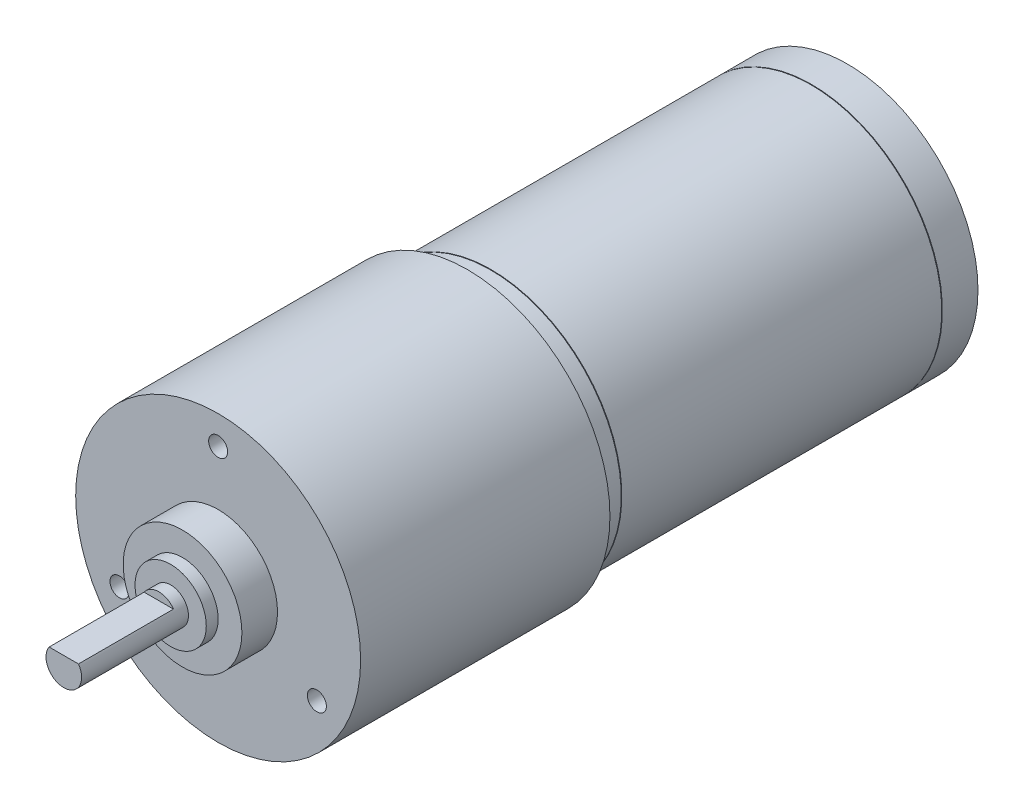
from build123d import *

# Parameters (mm, degrees)
SKETCH_1_R             = 11
EXTRUDE_1_DEPTH        = 32
HOLE_WIZARD_M2_1_D     = 1.6
HOLE_WIZARD_M2_1_DEPTH = 5.2
HOLE_WIZARD_M2_1_TIP   = 0.480688495
CUT_EXTRUDE_START      = -3
SKETCH_5_R             = 11.838448527
SKETCH_5_R_2           = 10.75
CUT_EXTRUDE_1_DEPTH    = 0.05
CUT_EXTRUDE_START_2    = -30
SKETCH_5_2_R           = 11.838448527
SKETCH_5_2_R_2         = 10.75
CUT_EXTRUDE_2_DEPTH    = 0.05
SKETCH_6_R             = 12
EXTRUDE_2_DEPTH        = 21
SKETCH_7_R             = 5
EXTRUDE_3_DEPTH        = 3
SKETCH_8_R             = 3
EXTRUDE_4_DEPTH        = 4
SKETCH_9_R             = 1.5
EXTRUDE_5_DEPTH        = 13
SKETCH_10_W            = 5.142844332
SKETCH_10_H            = 1.571012966
CUT_EXTRUDE_3_DEPTH    = 8
HOLE_WIZARD_M2_2_D     = 1.6
HOLE_WIZARD_M2_2_DEPTH = 5.2
HOLE_WIZARD_M2_2_TIP   = 0.480688495


with BuildPart() as part:
    # 草图1 → 凸台-拉伸1 (new body)
    with BuildSketch(Plane.XY):
        Circle(SKETCH_1_R)
    extrude(amount=EXTRUDE_1_DEPTH)

    # M2 螺纹孔1
    with Locations(Plane(origin=(0, 8.5, 32), x_dir=(1, 0, 0), z_dir=(0, 0, 1))):
        with Locations((0, 0), (0, -17)):
            Hole(HOLE_WIZARD_M2_1_D / 2, depth=HOLE_WIZARD_M2_1_DEPTH)
            with Locations((0, 0, -(HOLE_WIZARD_M2_1_DEPTH + HOLE_WIZARD_M2_1_TIP / 2))):  # 118° drill point
                Cone(0, HOLE_WIZARD_M2_1_D / 2, HOLE_WIZARD_M2_1_TIP, mode=Mode.SUBTRACT)

    # 草图5 → 切除-拉伸1 (cut)
    with BuildSketch(Plane(origin=(0, 0, 0), x_dir=(-1, 0, 0), z_dir=(0, 0, -1)).offset(CUT_EXTRUDE_START)):
        Circle(SKETCH_5_R)
        Circle(SKETCH_5_R_2, mode=Mode.SUBTRACT)
    extrude(amount=-CUT_EXTRUDE_1_DEPTH, mode=Mode.SUBTRACT)

    # 草图5<2> → 切除-拉伸2 (cut)
    with BuildSketch(Plane(origin=(0, 0, 0), x_dir=(-1, 0, 0), z_dir=(0, 0, -1)).offset(CUT_EXTRUDE_START_2)):
        Circle(SKETCH_5_2_R)
        Circle(SKETCH_5_2_R_2, mode=Mode.SUBTRACT)
    extrude(amount=-CUT_EXTRUDE_2_DEPTH, mode=Mode.SUBTRACT)

    # 草图6 → 凸台-拉伸2 (add)
    with BuildSketch(Plane.XY.offset(32)):
        Circle(SKETCH_6_R)
    extrude(amount=EXTRUDE_2_DEPTH)

    # 草图7 → 凸台-拉伸3 (add)
    with BuildSketch(Plane.XY.offset(53)):
        Circle(SKETCH_7_R)
    extrude(amount=EXTRUDE_3_DEPTH)

    # 草图8 → 凸台-拉伸4 (add)
    with BuildSketch(Plane.XY.offset(53)):
        Circle(SKETCH_8_R)
    extrude(amount=EXTRUDE_4_DEPTH)

    # 草图9 → 凸台-拉伸5 (add)
    with BuildSketch(Plane.XY.offset(53)):
        Circle(SKETCH_9_R)
    extrude(amount=EXTRUDE_5_DEPTH)

    # 草图10 → 切除-拉伸3 (cut)
    with BuildSketch(Plane.XY.offset(66)):
        with Locations((0.334320666, 1.635506483)):
            Rectangle(SKETCH_10_W, SKETCH_10_H)
    extrude(amount=-CUT_EXTRUDE_3_DEPTH, mode=Mode.SUBTRACT)

    # M2 螺纹孔2
    with Locations(Plane(origin=(0, 9.6, 53), x_dir=(1, 0, 0), z_dir=(0, 0, 1))):
        with Locations((0, 0), (8.313843876, -14.4), (-8.313843876, -14.4)):
            Hole(HOLE_WIZARD_M2_2_D / 2, depth=HOLE_WIZARD_M2_2_DEPTH)
            with Locations((0, 0, -(HOLE_WIZARD_M2_2_DEPTH + HOLE_WIZARD_M2_2_TIP / 2))):  # 118° drill point
                Cone(0, HOLE_WIZARD_M2_2_D / 2, HOLE_WIZARD_M2_2_TIP, mode=Mode.SUBTRACT)


solid = part.part
